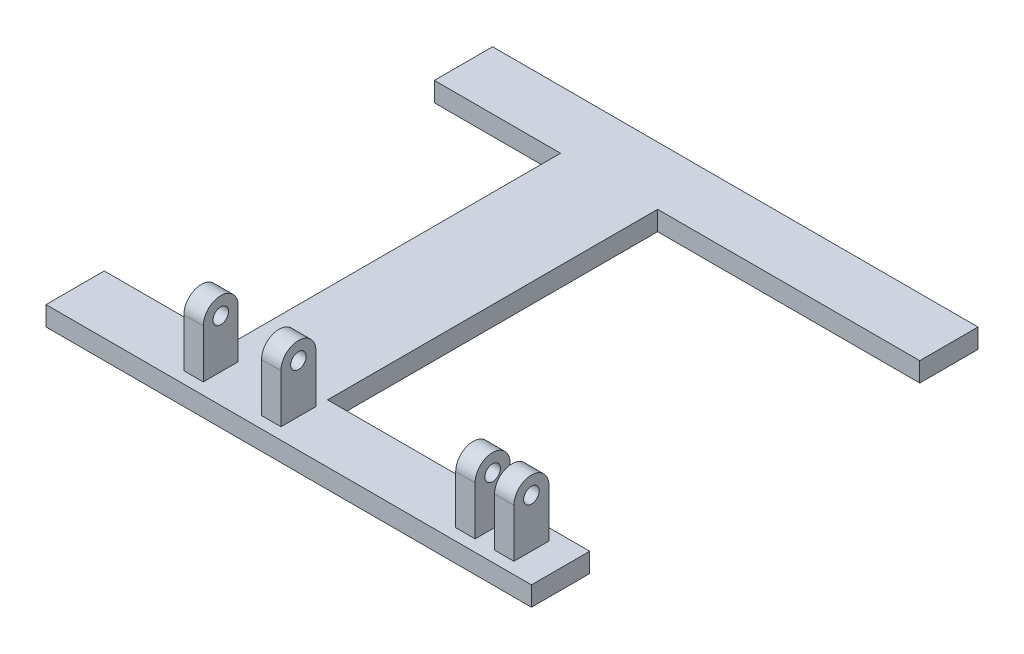
from build123d import *

# Parameters (mm, degrees)
BOSS_EXTRUDE1_DEPTH = 10
SKETCH2_R           = 4
BOSS_EXTRUDE2_DEPTH = 10
LPATTERN1_COUNT     = 2
LPATTERN1_PITCH     = 40
LPATTERN2_COUNT     = 2
LPATTERN2_PITCH     = 140
LPATTERN4_COUNT     = 2
LPATTERN4_PITCH     = 160


with BuildPart() as part:
    # Sketch1 → Boss-Extrude1 (new body)
    with BuildSketch(Plane(origin=(0, 0, 0), x_dir=(1, 0, 0), z_dir=(0, 1, 0))):
        Polygon((-125, 90.549169605), (125, 90.549169605), (125, 60.549169605), (-10, 60.549169605), (-10, -109.450830395), (125, -109.450830395), (125, -139.450830395), (-125, -139.450830395), (-125, -109.450830395), (-60, -109.450830395), (-60, 60.549169605), (-125, 60.549169605), align=None)
    extrude(amount=BOSS_EXTRUDE1_DEPTH)

    # Sketch2 → Boss-Extrude2 (add)
    with BuildSketch(Plane.ZY.offset(60)):
        with BuildLine():
            Line((115.450830395, 10), (133.450830395, 10))
            Line((133.450830395, 10), (133.450830395, 35))
            ThreePointArc((133.450830395, 35), (124.450830395, 44), (115.450830395, 35))
            Line((115.450830395, 35), (115.450830395, 10))
        make_face()
        with Locations((124.450830395, 35)):
            Circle(SKETCH2_R, mode=Mode.SUBTRACT)
    boss_extrude2 = extrude(amount=-BOSS_EXTRUDE2_DEPTH)

    # LPattern1: Boss-Extrude2 ×2
    with Locations(*[(i * LPATTERN1_PITCH, 0, 0) for i in range(1, LPATTERN1_COUNT)]):
        add(boss_extrude2)

    # LPattern2: Boss-Extrude2 ×2
    with Locations(*[(i * LPATTERN2_PITCH, 0, 0) for i in range(1, LPATTERN2_COUNT)]):
        add(boss_extrude2)

    # LPattern4: Boss-Extrude2 ×2
    with Locations(*[(i * LPATTERN4_PITCH, 0, 0) for i in range(1, LPATTERN4_COUNT)]):
        add(boss_extrude2)


solid = part.part
